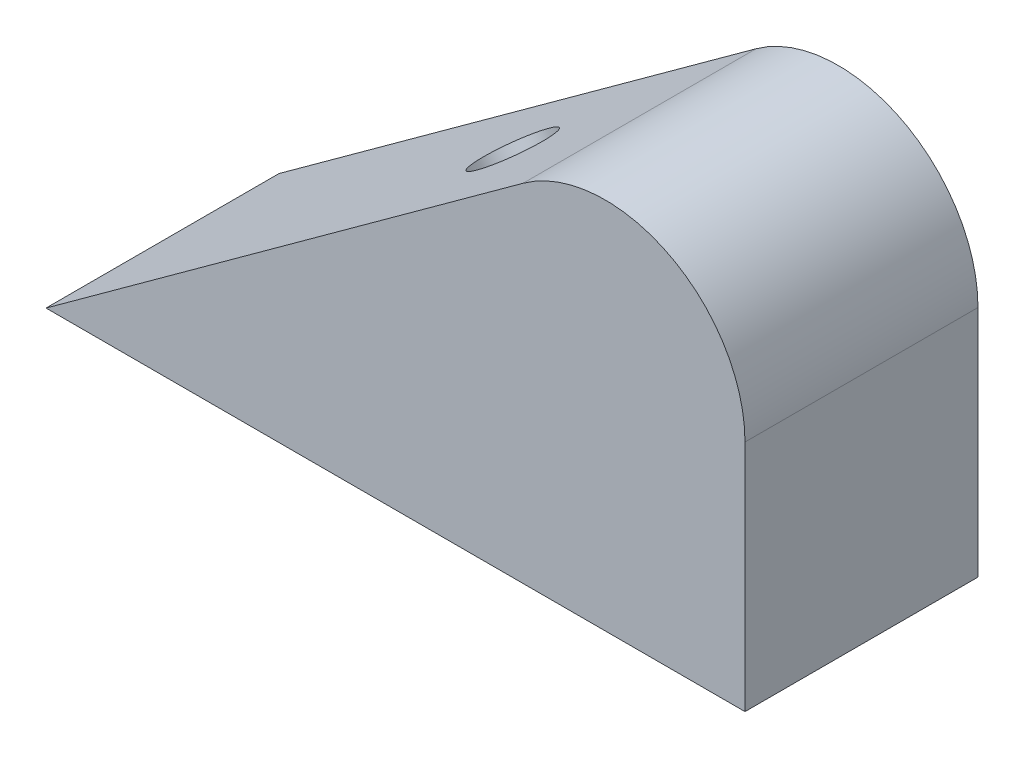
from build123d import *

# Parameters (mm, degrees)
BOSS_EXTRUDE1_DEPTH = 12.7
SKETCH2_R           = 2.5796875
CUT_EXTRUDE1_DEPTH  = 5.08
SKETCH3_R           = 1.984375
CUT_EXTRUDE2_DEPTH  = 5.08
FILLET1_R           = 7.62


with BuildPart() as part:
    # Sketch1 → Boss-Extrude1 (new body)
    with BuildSketch(Plane.XY):
        Polygon((-32.22474981, 0), (5.87525019, 27.681270317), (5.87525019, 0), align=None)
    extrude(amount=BOSS_EXTRUDE1_DEPTH)

    # Sketch2 → Cut-Extrude1 (cut)
    with BuildSketch(Plane.XZ):
        with Locations((-13.17474981, 6.35)):
            Circle(SKETCH2_R)
    extrude(amount=-CUT_EXTRUDE1_DEPTH, mode=Mode.SUBTRACT)

    # Sketch3 → Cut-Extrude2 (cut)
    with BuildSketch(Plane(origin=(-11.13337724, 15.323779146, 0), x_dir=(0.8090169943749507, 0.5877852522924687, 0), z_dir=(-0.5877852522924687, 0.8090169943749507, 0))):
        with Locations(Location((-2.471180293, -6.35, 0), (0, 0, 180))):
            Circle(SKETCH3_R)
    extrude(amount=-CUT_EXTRUDE2_DEPTH, mode=Mode.SUBTRACT)

    # Fillet1
    fillet1_edges = [part.edges().sort_by_distance(p)[0] for p in [
        (5.87525019, 27.681270317, 6.35),
    ]]
    fillet(fillet1_edges, radius=FILLET1_R)


solid = part.part
